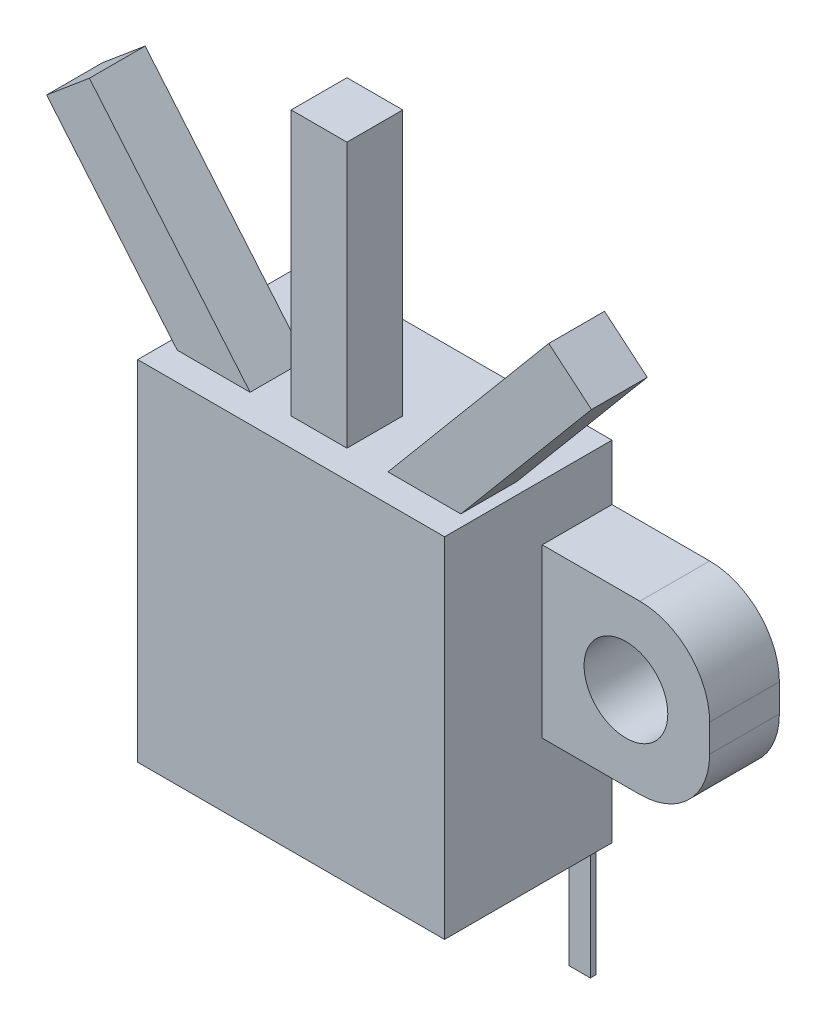
from build123d import *

# Parameters (mm, degrees)
P_IDAT_VYSUNUT_M1_DEPTH  = 6
SKICA2_W                 = 6
SKICA2_H                 = 6
ODEBRAT_VYSUNUT_M1_DEPTH = 3.5
SKICA3_R                 = 1.5
ODEBRAT_VYSUNUT_M2_DEPTH = 3.5
SKICA4_W                 = 0.765185498
SKICA4_H                 = 4.384382678
SKICA4_W_2               = 0.586642215
SKICA4_W_3               = 0.510123665
P_IDAT_VYSUNUT_M2_DEPTH  = 0.2
SKICA5_W                 = 2
SKICA5_H                 = 9.5
P_IDAT_VYSUNUT_M3_DEPTH  = 2
SKICA6_R                 = 1
P_IDAT_VYSUNUT_M4_DEPTH  = 1.8
ZAOBLIT1_R               = 2.5


with BuildPart() as part:
    # Skica1 → Přidat vysunutím1 (new body)
    with BuildSketch(Plane.XY):
        Polygon((0, 0), (0, 12.5), (11, 12.5), (11, 10.5), (17, 10.5), (17, 4.5), (11, 4.5), (11, 0), align=None)
    extrude(amount=P_IDAT_VYSUNUT_M1_DEPTH)

    # Skica2 → Odebrat vysunutím1 (cut)
    with BuildSketch(Plane.XY.offset(6)):
        with Locations((14, 7.5)):
            Rectangle(SKICA2_W, SKICA2_H)
    extrude(amount=-ODEBRAT_VYSUNUT_M1_DEPTH, mode=Mode.SUBTRACT)

    # Skica3 → Odebrat vysunutím2 (cut)
    with BuildSketch(Plane.XY.offset(2.5)):
        with Locations((14, 7.5)):
            Circle(SKICA3_R)
    extrude(amount=-ODEBRAT_VYSUNUT_M2_DEPTH, mode=Mode.SUBTRACT)

    # Skica4 → Přidat vysunutím2 (add)
    with BuildSketch(Plane(origin=(0, 0, 0), x_dir=(-1, 0, 0), z_dir=(0, 0, -1))):
        with Locations((-10.040395208, -2.192191339)):
            Rectangle(SKICA4_W, SKICA4_H)
        with Locations((-5.513047674, -2.192191339)):
            Rectangle(SKICA4_W_2, SKICA4_H)
        with Locations((-0.934687773, -2.192191339)):
            Rectangle(SKICA4_W_3, SKICA4_H)
    extrude(amount=-P_IDAT_VYSUNUT_M2_DEPTH)

    # Skica5 → Přidat vysunutím3 (add)
    with BuildSketch(Plane.XY.offset(5)):
        with Locations((5.5, 17.25)):
            Rectangle(SKICA5_W, SKICA5_H)
        Polygon((7.6264998, 12.089987604), (13.732982092, 19.367409813), (15.265070979, 18.081834594), (9.158588687, 10.804412384), align=None)
        Polygon((1.841411313, 10.804412384), (-4.265070979, 18.081834594), (-2.732982092, 19.367409813), (3.3735002, 12.089987604), align=None)
    extrude(amount=-P_IDAT_VYSUNUT_M3_DEPTH)

    # Skica6 → Přidat vysunutím4 (add)
    with BuildSketch(Plane(origin=(0, 0, 0), x_dir=(-1, 0, 0), z_dir=(0, 0, -1))):
        with Locations((-5.5, 7.5)):
            Circle(SKICA6_R)
    extrude(amount=P_IDAT_VYSUNUT_M4_DEPTH)

    # Zaoblit1
    zaoblit1_edges = [part.edges().sort_by_distance(p)[0] for p in [
        (17, 10.5, 1.25),
        (17, 4.5, 1.25),
    ]]
    fillet(zaoblit1_edges, radius=ZAOBLIT1_R)


solid = part.part
